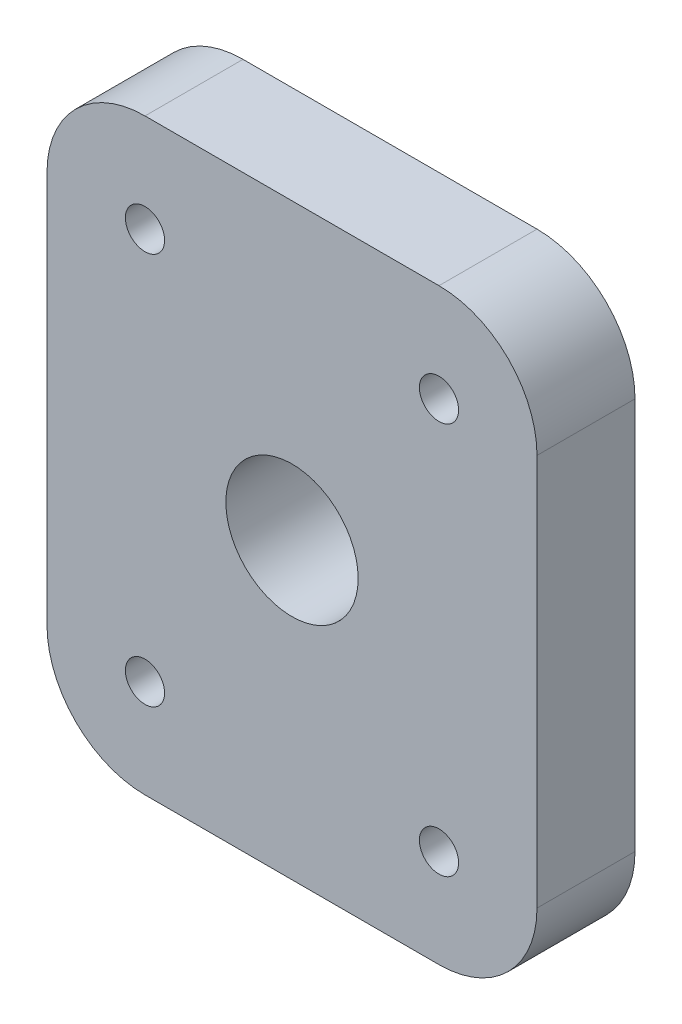
from build123d import *

# Parameters (mm, degrees)
MODEL_R             = 6.75
MODEL_R_2           = 2
BOSS_EXTRUDE1_DEPTH = 10


with BuildPart() as part:
    # Model → Boss-Extrude1 (new body)
    with BuildSketch(Plane.XY):
        with BuildLine():
            Line((106.910569106, 50), (106.910569106, 10))
            ThreePointArc((106.910569106, 10), (109.839501294, 2.928932188), (116.910569106, 0))
            Line((116.910569106, 0), (146.910569106, 0))
            ThreePointArc((146.910569106, 0), (153.981636918, 2.928932188), (156.910569106, 10))
            Line((156.910569106, 10), (156.910569106, 50))
            ThreePointArc((156.910569106, 50), (153.981636918, 57.071067812), (146.910569106, 60))
            Line((146.910569106, 60), (116.910569106, 60))
            ThreePointArc((116.910569106, 60), (109.839501294, 57.071067812), (106.910569106, 50))
        make_face()
        with Locations((131.910569106, 30)):
            Circle(MODEL_R, mode=Mode.SUBTRACT)
        with Locations((146.910569106, 10)):
            Circle(MODEL_R_2, mode=Mode.SUBTRACT)
        with Locations((146.910569106, 50)):
            Circle(MODEL_R_2, mode=Mode.SUBTRACT)
        with Locations((116.910569106, 50)):
            Circle(MODEL_R_2, mode=Mode.SUBTRACT)
        with Locations((116.910569106, 10)):
            Circle(MODEL_R_2, mode=Mode.SUBTRACT)
    extrude(amount=BOSS_EXTRUDE1_DEPTH)


solid = part.part
